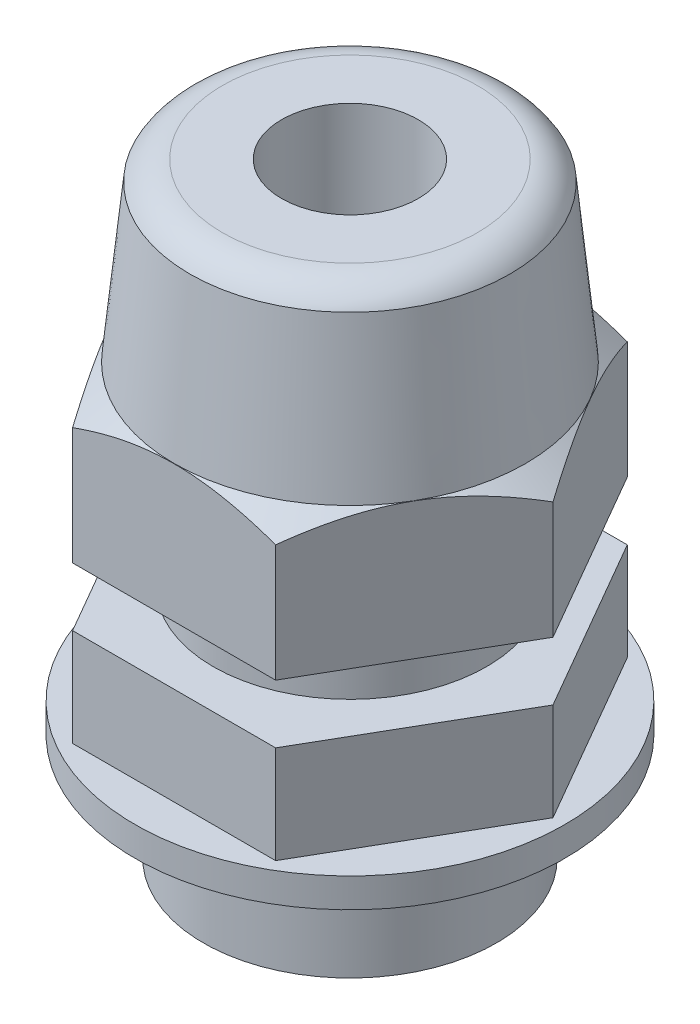
from build123d import *

# Parameters (mm, degrees)
EXTRUDE_1_DEPTH     = 24
SKETCH_3_W          = 3.392304845
SKETCH_3_H          = 3
SKETCH_4_R          = 7.5
EXTRUDE_2_DEPTH     = 7
SKETCH_5_R          = 5
CUT_EXTRUDE_1_DEPTH = 34.911649916
EXTRUDE_START       = -12
SKETCH_6_R          = 5
SKETCH_6_R_2        = 3.5
EXTRUDE_3_DEPTH     = 12
CHAMFER_1_SIZE      = 5.5
CHAMFER_1_SIZE2     = 1.473720558
SKETCH_7_R          = 11
EXTRUDE_4_DEPTH     = 1.5


with BuildPart() as part:
    # Эскиз1 → Вытянуть1 (new body)
    with BuildSketch(Plane(origin=(0, 0, 0), x_dir=(1, 0, 0), z_dir=(0, 1, 0))):
        Polygon((-5.196152423, 9), (5.196152423, 9), (10.392304845, 0), (5.196152423, -9), (-5.196152423, -9), (-10.392304845, 0), align=None)
    extrude(amount=-EXTRUDE_1_DEPTH)

    # Эскиз2 → Вырез-Повернуть1 (revolve, cut)
    with BuildSketch(Plane.XY, mode=Mode.PRIVATE) as cut_revolve_1_sk:
        with BuildLine():
            Line((8.992304845, -9), (10.392304845, -10))
            Line((10.392304845, -10), (11.881416036, -10))
            Line((11.881416036, -10), (11.881416036, 2.231526293))
            Line((11.881416036, 2.231526293), (6.392304845, 2.231526293))
            Line((6.392304845, 2.231526293), (6.392304845, 0))
            ThreePointArc((6.392304845, 0), (7.430886543, -0.250552945), (8.192304845, -1))
            Line((8.192304845, -1), (8.992304845, -9))
        make_face()
    revolve(cut_revolve_1_sk.sketch.rotate(Axis((0, 9.980849864, 0), (0, -1, 0)), 90), axis=Axis((0, 9.980849864, 0), (0, -1, 0)), mode=Mode.SUBTRACT)

    # Эскиз3 → Вырез-Повернуть2 (revolve, cut)
    with BuildSketch(Plane.XY, mode=Mode.PRIVATE) as cut_revolve_2_sk:
        with Locations((8.696152422, -17.5)):
            Rectangle(SKETCH_3_W, SKETCH_3_H)
    revolve(cut_revolve_2_sk.sketch.rotate(Axis((0, 9.980849864, 0), (0, -1, 0)), 300.000000019), axis=Axis((0, 9.980849864, 0), (0, -1, 0)), mode=Mode.SUBTRACT)

    # Эскиз4 → Вытянуть2 (add)
    with BuildSketch(Plane.XZ.offset(24)):
        with Locations(Location((0, 0, 0), (0, 0, 90))):
            Circle(SKETCH_4_R)
    extrude(amount=EXTRUDE_2_DEPTH)

    # Эскиз5 → Вырез-Вытянуть1 (cut, through all)
    with BuildSketch(Plane.XZ.offset(31)):
        with Locations(Location((0, 0, 0), (0, 0, 270))):
            Circle(SKETCH_5_R)
    extrude(amount=-CUT_EXTRUDE_1_DEPTH, mode=Mode.SUBTRACT)

    # Эскиз6 → Вытянуть3 (add)
    with BuildSketch(Plane(origin=(0, 0, 0), x_dir=(-1, 0, 0), z_dir=(0, 1, 0)).offset(EXTRUDE_START)):
        with Locations(Location((0, 0, 0), (0, 0, 270))):
            Circle(SKETCH_6_R)
        with Locations(Location((0, 0, 0), (0, 0, 90))):
            Circle(SKETCH_6_R_2, mode=Mode.SUBTRACT)
    extrude(amount=EXTRUDE_3_DEPTH)

    # Фаска1
    chamfer_1_edges = [part.edges().sort_by_distance(p)[0] for p in [
        (0, -12, 5),
    ]]
    chamfer_1_side = [part.faces().sort_by_distance(p)[0] for p in [
        (0, -21.5, 5),
    ]]
    chamfer(chamfer_1_edges, length=CHAMFER_1_SIZE, length2=CHAMFER_1_SIZE2, reference=chamfer_1_side[0])

    # Эскиз7 → Вытянуть4 (add)
    with BuildSketch(Plane.XZ.offset(24)):
        with Locations(Location((0, 0, 0), (0, 0, 270))):
            Circle(SKETCH_7_R)
    extrude(amount=EXTRUDE_4_DEPTH)


solid = part.part
